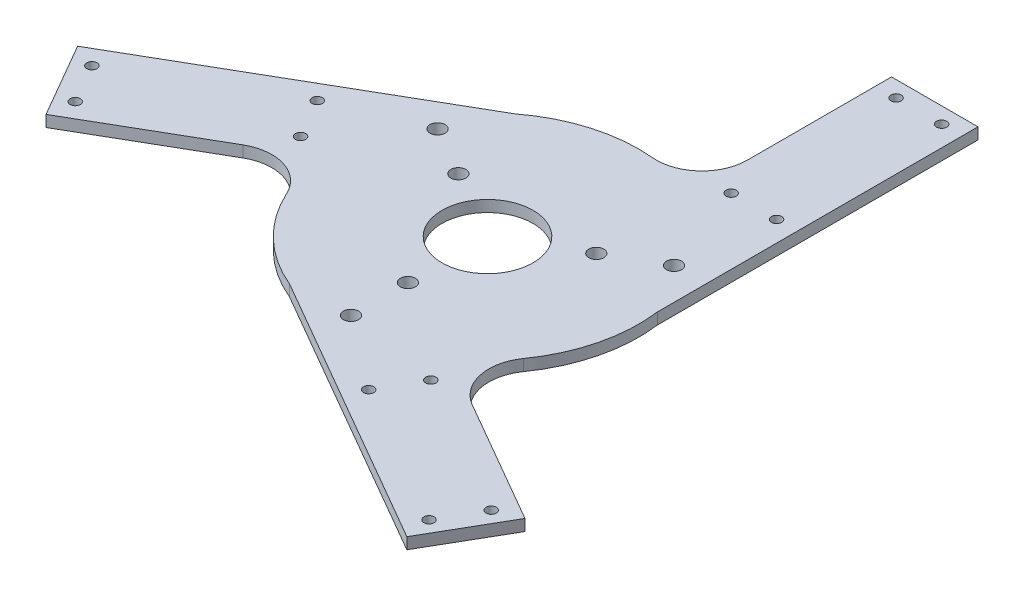
from build123d import *

# Parameters (mm, degrees)
EXTRUDE_1_DEPTH        = 5
SKETCH_3_R             = 20
CUT_EXTRUDE_1_DEPTH    = 221.897762361
HOLE_WIZARD_M6_1_D     = 6.6
HOLE_WIZARD_M4_2_D     = 4.5
HOLE_WIZARD_M4_2_DEPTH = 10
HOLE_WIZARD_M4_2_TIP   = 1.351936393


with BuildPart() as part:
    # 스케치2 → 보스-돌출1 (new body)
    with BuildSketch(Plane(origin=(0, 0, 0), x_dir=(1, 0, 0), z_dir=(0, 1, 0))):
        with BuildLine():
            Line((66.01, 8.662039246), (66.01, 149.538220784))
            Line((66.01, 149.538220784), (28.01, 149.538220784))
            Line((28.01, 149.538220784), (28.01, 86.204565384))
            ThreePointArc((28.01, 86.204565384), (21.482045359, 71.422684791), (6.159600614, 66.290348801))
            ThreePointArc((6.159600614, 66.290348801), (-18.444176134, 63.970019467), (-40.506546036, 52.835317281))
            Line((-40.506546036, 52.835317281), (-162.508898036, -17.602773488))
            Line((-162.508898036, -17.602773488), (-143.508898036, -50.511738832))
            Line((-143.508898036, -50.511738832), (-88.660343545, -18.844911132))
            ThreePointArc((-88.660343545, -18.844911132), (-72.594882115, -17.10734539), (-60.488926395, -27.810803791))
            ThreePointArc((-60.488926395, -27.810803791), (-46.177573873, -47.958134817), (-25.503453964, -61.497356527))
            Line((-25.503453964, -61.497356527), (96.498898036, -131.935447296))
            Line((96.498898036, -131.935447296), (115.498898036, -99.026481952))
            Line((115.498898036, -99.026481952), (60.650343545, -67.359654252))
            ThreePointArc((60.650343545, -67.359654252), (51.112836757, -54.315339401), (54.32932578, -38.47954501))
            ThreePointArc((54.32932578, -38.47954501), (64.621750006, -16.01188465), (66.01, 8.662039246))
        make_face()
    extrude(amount=-EXTRUDE_1_DEPTH)

    # 스케치3 → 컷-돌출1 (cut, through all)
    with BuildSketch(Plane(origin=(0, -5, 0), x_dir=(-1, 0, 0), z_dir=(0, -1, 0))):
        with Locations(Location((0, 0, 0), (0, 0, 90))):
            Circle(SKETCH_3_R)
    extrude(amount=-CUT_EXTRUDE_1_DEPTH, mode=Mode.SUBTRACT)

    # M6 여유 구멍1 (through all)
    with Locations(Plane(origin=(0, -5, 0), x_dir=(-1, 0, 0), z_dir=(0, -1, 0))):
        with Locations((30.310889132, 17.5), (0, -60), (0, -35), (-51.961524227, 30), (-30.310889132, 17.5), (51.961524227, 30)):
            Hole(HOLE_WIZARD_M6_1_D / 2)

    # M4 여유 구멍2
    with Locations(Plane(origin=(0, 0, 0), x_dir=(1, 0, 0), z_dir=(0, 1, 0))):
        with Locations((57.01, 142.538220784), (37.01, 142.538220784), (37.01, 70.038220784), (57.01, 70.038220784), (94.936720209, -120.641218662), (104.936720209, -103.320710586), (42.149878435, -67.070710586), (32.149878435, -84.391218662), (-151.946720209, -21.897002122), (-141.946720209, -39.217510198), (-79.159878435, -2.967510198), (-89.159878435, 14.352997878)):
            Hole(HOLE_WIZARD_M4_2_D / 2, depth=HOLE_WIZARD_M4_2_DEPTH)
            with Locations((0, 0, -(HOLE_WIZARD_M4_2_DEPTH + HOLE_WIZARD_M4_2_TIP / 2))):  # 118° drill point
                Cone(0, HOLE_WIZARD_M4_2_D / 2, HOLE_WIZARD_M4_2_TIP, mode=Mode.SUBTRACT)


solid = part.part
